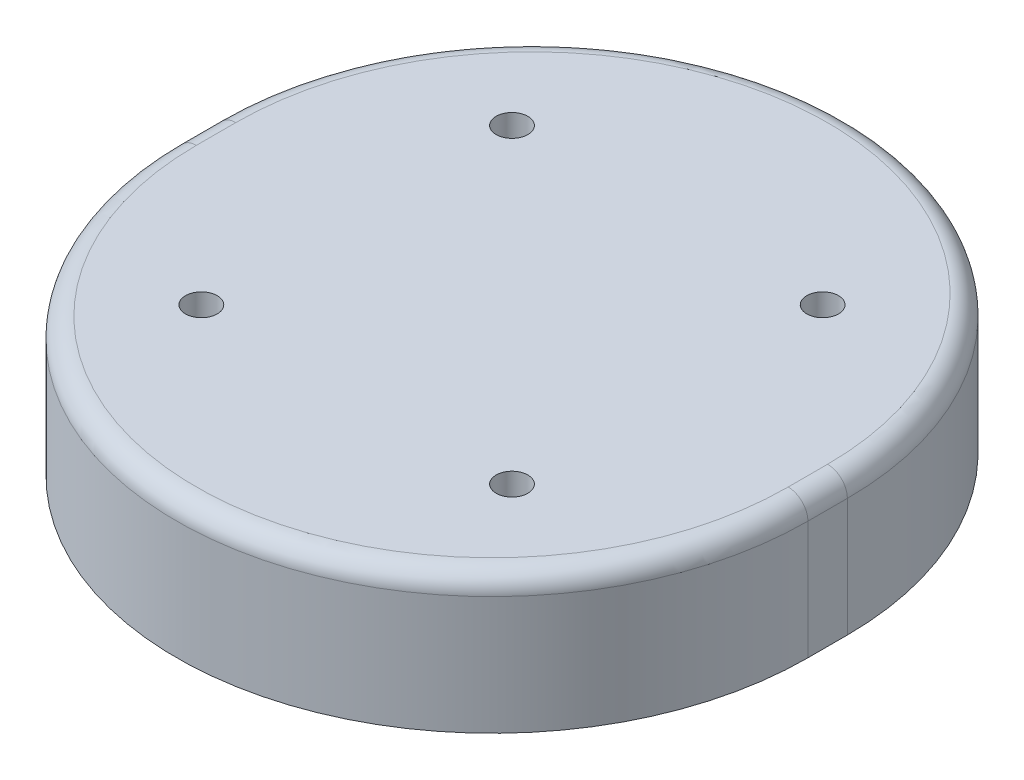
from build123d import *

# Parameters (mm, degrees)
BOSS_EXTRUDE1_DEPTH         = 22.225
F_1_4_20_TAPPED_HOLE1_D     = 5.1054
F_1_4_20_TAPPED_HOLE1_DEPTH = 12.7
F_1_4_20_TAPPED_HOLE1_TIP   = 1.533816902
FILLET1_R                   = 3.175


with BuildPart() as part:
    # Sketch1 → Boss-Extrude1 (new body)
    with BuildSketch(Plane(origin=(0, 0, 0), x_dir=(1, 0, 0), z_dir=(0, 1, 0))):
        with BuildLine():
            Line((50.8, 3.175), (50.8, -3.175))
            ThreePointArc((50.8, -3.175), (0, -53.975), (-50.8, -3.175))
            Line((-50.8, -3.175), (-50.8, 3.175))
            ThreePointArc((-50.8, 3.175), (0, 53.975), (50.8, 3.175))
        make_face()
    extrude(amount=BOSS_EXTRUDE1_DEPTH)

    # 1/4-20 Tapped Hole1
    with Locations(Plane(origin=(0, 22.225, 0), x_dir=(1, 0, 0), z_dir=(0, 1, 0))):
        with Locations((-24.99995, 24.99995), (24.99995, 24.99995), (24.99995, -24.99995), (-24.99995, -24.99995)):
            Hole(F_1_4_20_TAPPED_HOLE1_D / 2, depth=F_1_4_20_TAPPED_HOLE1_DEPTH)
            with Locations((0, 0, -(F_1_4_20_TAPPED_HOLE1_DEPTH + F_1_4_20_TAPPED_HOLE1_TIP / 2))):  # 118° drill point
                Cone(0, F_1_4_20_TAPPED_HOLE1_D / 2, F_1_4_20_TAPPED_HOLE1_TIP, mode=Mode.SUBTRACT)

    # Fillet1
    fillet1_edges = [part.edges().sort_by_distance(p)[0] for p in [
        (0, 22.225, 53.975),
        (50.8, 22.225, 0),
        (0, 22.225, -53.975),
        (-50.8, 22.225, 0),
    ]]
    fillet(fillet1_edges, radius=FILLET1_R)


solid = part.part
